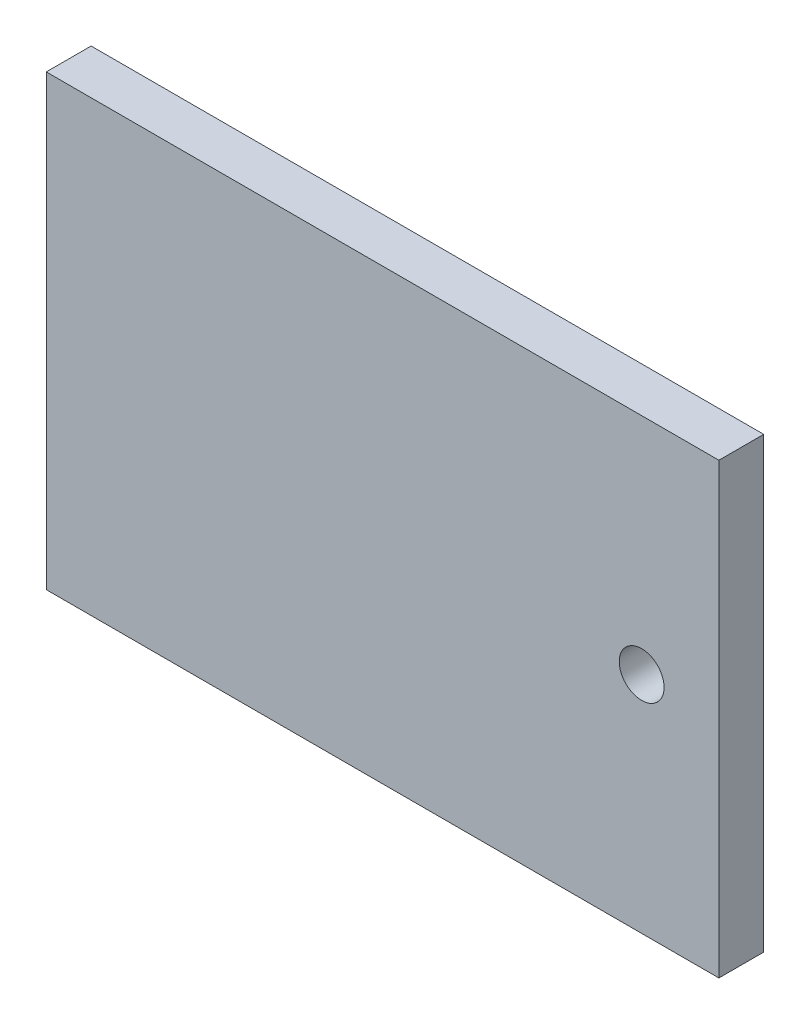
from build123d import *

# Parameters (mm, degrees)
SKETCH_1_W          = 30
SKETCH_1_H          = 20
EXTRUDE_1_DEPTH     = 2
SKETCH_2_R          = 1
CUT_EXTRUDE_1_DEPTH = 2


with BuildPart() as part:
    # 스케치1 → 보스-돌출1 (new body)
    with BuildSketch(Plane.XY):
        Rectangle(SKETCH_1_W, SKETCH_1_H)
    extrude(amount=EXTRUDE_1_DEPTH)

    # 스케치2 → 컷-돌출1 (cut)
    with BuildSketch(Plane.XY.offset(2)):
        with Locations((11.555346509, 0)):
            Circle(SKETCH_2_R)
    extrude(amount=-CUT_EXTRUDE_1_DEPTH, mode=Mode.SUBTRACT)


solid = part.part
